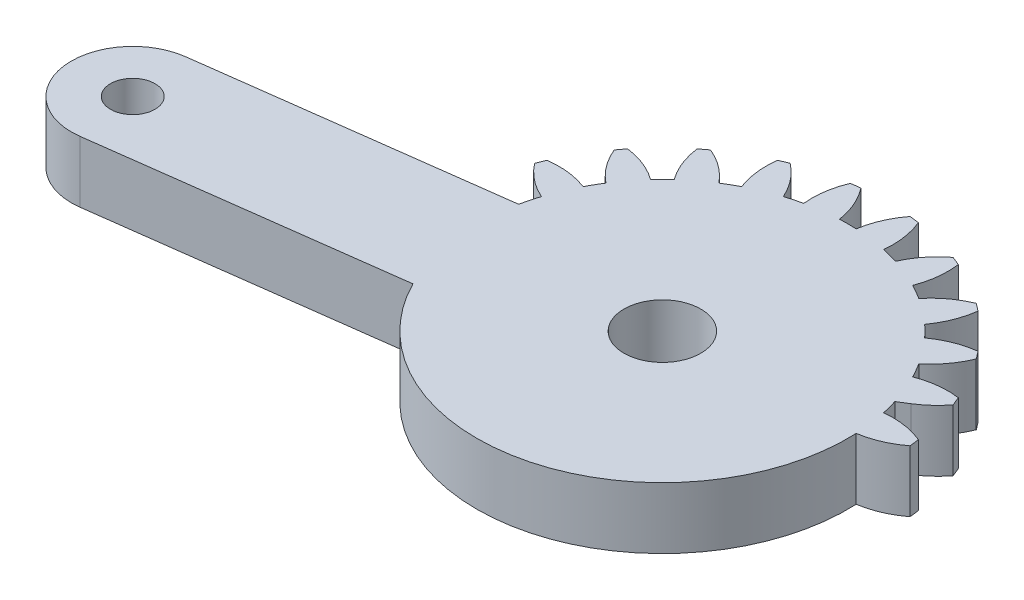
from build123d import *
from build123d.topology import SkipClean

# Parameters (mm, degrees)
SKETCH1_R           = 1.5
BOSS_EXTRUDE1_DEPTH = 4
SKETCH3_R           = 1.45
BOSS_EXTRUDE2_DEPTH = 4
CUT_EXTRUDE1_START  = -4
CUT_EXTRUDE1_DEPTH  = 4
CUT_EXTRUDE2_REACH  = 49.073
SKETCH5_R           = 2.5


with BuildPart() as part:
    # Sketch1 → Boss-Extrude1 (new body)
    with BuildSketch(Plane(origin=(0, 0, 0), x_dir=(1, 0, 0), z_dir=(0, 1, 0))):
        with BuildLine():
            Line((20.643657446, 4), (2.081641936, 4))
            ThreePointArc((2.081641936, 4), (2.861028333, 4.588201733), (3.521749436, 5.30713988))
            ThreePointArc((3.521749436, 5.30713988), (3.405395609, 5.596745198), (3.282888305, 5.883801663))
            ThreePointArc((3.282888305, 5.883801663), (1.93527598, 5.894040025), (0.627094961, 5.57027124))
            ThreePointArc((0.627094961, 5.57027124), (0.366286148, 6.046375), (0.084372603, 6.510293938))
            ThreePointArc((0.084372603, 6.510293938), (1.018855105, 7.48132754), (1.683794586, 8.65351323))
            ThreePointArc((1.683794586, 8.65351323), (1.496450048, 8.903135899), (1.303821399, 9.148703928))
            ThreePointArc((1.303821399, 9.148703928), (-0.000522033, 8.809805691), (-1.180330337, 8.158486898))
            ThreePointArc((-1.180330337, 8.158486898), (-1.555477026, 8.550865528), (-1.947855656, 8.926012217))
            ThreePointArc((-1.947855656, 8.926012217), (-1.296536862, 10.105820521), (-0.957638625, 11.410163953))
            ThreePointArc((-0.957638625, 11.410163953), (-1.203206655, 11.602792602), (-1.452829324, 11.79013714))
            ThreePointArc((-1.452829324, 11.79013714), (-2.625015014, 11.125197659), (-3.596048616, 10.190715157))
            ThreePointArc((-3.596048616, 10.190715157), (-4.059967554, 10.472628702), (-4.536071314, 10.733437515))
            ThreePointArc((-4.536071314, 10.733437515), (-4.212302529, 12.041618533), (-4.222540891, 13.389230859))
            ThreePointArc((-4.222540891, 13.389230859), (-4.509597355, 13.511738163), (-4.799202674, 13.62809199))
            ThreePointArc((-4.799202674, 13.62809199), (-5.759348103, 12.682425791), (-6.455432668, 11.528463019))
            ThreePointArc((-6.455432668, 11.528463019), (-6.976508546, 11.680699536), (-7.503891752, 11.809396783))
            ThreePointArc((-7.503891752, 11.809396783), (-7.529737283, 13.156800143), (-7.888414517, 14.455843809))
            ThreePointArc((-7.888414517, 14.455843809), (-8.197396993, 14.499881098), (-8.507248835, 14.537314892))
            ThreePointArc((-8.507248835, 14.537314892), (-9.18992168, 13.375367565), (-9.563620196, 12.080565177))
            ThreePointArc((-9.563620196, 12.080565177), (-10.106342554, 12.09275), (-10.649064912, 12.080565177))
            ThreePointArc((-10.649064912, 12.080565177), (-11.022763428, 13.375367565), (-11.705436272, 14.537314892))
            ThreePointArc((-11.705436272, 14.537314892), (-12.015288115, 14.499881098), (-12.324270591, 14.455843809))
            ThreePointArc((-12.324270591, 14.455843809), (-12.682947825, 13.156800143), (-12.708793355, 11.809396783))
            ThreePointArc((-12.708793355, 11.809396783), (-13.236176561, 11.680699536), (-13.757252439, 11.528463019))
            ThreePointArc((-13.757252439, 11.528463019), (-14.453337005, 12.682425791), (-15.413482434, 13.62809199))
            ThreePointArc((-15.413482434, 13.62809199), (-15.703087752, 13.511738163), (-15.990144217, 13.389230859))
            ThreePointArc((-15.990144217, 13.389230859), (-16.000382579, 12.041618533), (-15.676613793, 10.733437515))
            ThreePointArc((-15.676613793, 10.733437515), (-16.152717554, 10.472628702), (-16.616636492, 10.190715157))
            ThreePointArc((-16.616636492, 10.190715157), (-17.587670094, 11.125197659), (-18.759855783, 11.79013714))
            ThreePointArc((-18.759855783, 11.79013714), (-19.009478453, 11.602792602), (-19.255046482, 11.410163953))
            ThreePointArc((-19.255046482, 11.410163953), (-18.916148245, 10.105820521), (-18.264829452, 8.926012217))
            ThreePointArc((-18.264829452, 8.926012217), (-18.657208082, 8.550865528), (-19.032354771, 8.158486898))
            ThreePointArc((-19.032354771, 8.158486898), (-20.212163074, 8.809805691), (-21.516506507, 9.148703928))
            ThreePointArc((-21.516506507, 9.148703928), (-21.709135156, 8.903135899), (-21.896479694, 8.65351323))
            ThreePointArc((-21.896479694, 8.65351323), (-21.231540213, 7.48132754), (-20.297057711, 6.510293938))
            ThreePointArc((-20.297057711, 6.510293938), (-20.578971255, 6.046375), (-20.839780068, 5.57027124))
            ThreePointArc((-20.839780068, 5.57027124), (-22.147961087, 5.894040025), (-23.495573413, 5.883801663))
            ThreePointArc((-23.495573413, 5.883801663), (-23.618080717, 5.596745198), (-23.734434544, 5.30713988))
            ThreePointArc((-23.734434544, 5.30713988), (-22.788768345, 4.346994451), (-21.634805572, 3.650909885))
            ThreePointArc((-21.634805572, 3.650909885), (-21.78704209, 3.129834008), (-21.915739337, 2.602450802))
            ThreePointArc((-21.915739337, 2.602450802), (-23.263142697, 2.576605271), (-24.562186363, 2.217928037))
            ThreePointArc((-24.562186363, 2.217928037), (-24.606223651, 1.908945561), (-24.643657446, 1.599093719))
            ThreePointArc((-24.643657446, 1.599093719), (-23.481710119, 0.916420874), (-22.186907731, 0.542722358))
            ThreePointArc((-22.186907731, 0.542722358), (-22.199092554, 0), (-22.186907731, -0.542722358))
            ThreePointArc((-22.186907731, -0.542722358), (-23.481710119, -0.916420874), (-24.643657446, -1.599093719))
            ThreePointArc((-24.643657446, -1.599093719), (-24.606223651, -1.908945561), (-24.562186363, -2.217928037))
            ThreePointArc((-24.562186363, -2.217928037), (-23.263142697, -2.576605271), (-21.915739337, -2.602450802))
            ThreePointArc((-21.915739337, -2.602450802), (-21.78704209, -3.129834008), (-21.634805572, -3.650909885))
            ThreePointArc((-21.634805572, -3.650909885), (-22.788768345, -4.346994451), (-23.734434544, -5.30713988))
            ThreePointArc((-23.734434544, -5.30713988), (-23.618080717, -5.596745198), (-23.495573413, -5.883801663))
            ThreePointArc((-23.495573413, -5.883801663), (-22.147961087, -5.894040025), (-20.839780068, -5.57027124))
            ThreePointArc((-20.839780068, -5.57027124), (-20.578971255, -6.046375), (-20.297057711, -6.510293938))
            ThreePointArc((-20.297057711, -6.510293938), (-21.231540213, -7.48132754), (-21.896479694, -8.65351323))
            ThreePointArc((-21.896479694, -8.65351323), (-21.709135156, -8.903135899), (-21.516506507, -9.148703928))
            ThreePointArc((-21.516506507, -9.148703928), (-20.212163074, -8.809805691), (-19.032354771, -8.158486898))
            ThreePointArc((-19.032354771, -8.158486898), (-18.657208082, -8.550865528), (-18.264829452, -8.926012217))
            ThreePointArc((-18.264829452, -8.926012217), (-18.916148245, -10.105820521), (-19.255046482, -11.410163953))
            ThreePointArc((-19.255046482, -11.410163953), (-19.009478453, -11.602792602), (-18.759855783, -11.79013714))
            ThreePointArc((-18.759855783, -11.79013714), (-17.587670094, -11.125197659), (-16.616636492, -10.190715157))
            ThreePointArc((-16.616636492, -10.190715157), (-16.152717554, -10.472628702), (-15.676613793, -10.733437515))
            ThreePointArc((-15.676613793, -10.733437515), (-16.000382579, -12.041618533), (-15.990144217, -13.389230859))
            ThreePointArc((-15.990144217, -13.389230859), (-15.703087752, -13.511738163), (-15.413482434, -13.62809199))
            ThreePointArc((-15.413482434, -13.62809199), (-14.453337005, -12.682425791), (-13.757252439, -11.528463019))
            ThreePointArc((-13.757252439, -11.528463019), (-13.236176561, -11.680699536), (-12.708793355, -11.809396783))
            ThreePointArc((-12.708793355, -11.809396783), (-12.682947825, -13.156800143), (-12.324270591, -14.455843809))
            ThreePointArc((-12.324270591, -14.455843809), (-12.015288115, -14.499881098), (-11.705436272, -14.537314892))
            ThreePointArc((-11.705436272, -14.537314892), (-11.022763428, -13.375367565), (-10.649064912, -12.080565177))
            ThreePointArc((-10.649064912, -12.080565177), (-10.106342554, -12.09275), (-9.563620196, -12.080565177))
            ThreePointArc((-9.563620196, -12.080565177), (-9.18992168, -13.375367565), (-8.507248835, -14.537314892))
            ThreePointArc((-8.507248835, -14.537314892), (-8.197396993, -14.499881098), (-7.888414517, -14.455843809))
            ThreePointArc((-7.888414517, -14.455843809), (-7.529737283, -13.156800143), (-7.503891752, -11.809396783))
            ThreePointArc((-7.503891752, -11.809396783), (-6.976508546, -11.680699536), (-6.455432668, -11.528463019))
            ThreePointArc((-6.455432668, -11.528463019), (-5.759348103, -12.682425791), (-4.799202674, -13.62809199))
            ThreePointArc((-4.799202674, -13.62809199), (-4.509597355, -13.511738163), (-4.222540891, -13.389230859))
            ThreePointArc((-4.222540891, -13.389230859), (-4.212302529, -12.041618533), (-4.536071314, -10.733437515))
            ThreePointArc((-4.536071314, -10.733437515), (-4.059967554, -10.472628702), (-3.596048616, -10.190715157))
            ThreePointArc((-3.596048616, -10.190715157), (-2.625015014, -11.125197659), (-1.452829324, -11.79013714))
            ThreePointArc((-1.452829324, -11.79013714), (-1.203206655, -11.602792602), (-0.957638625, -11.410163953))
            ThreePointArc((-0.957638625, -11.410163953), (-1.296536862, -10.105820521), (-1.947855656, -8.926012217))
            ThreePointArc((-1.947855656, -8.926012217), (-1.555477026, -8.550865528), (-1.180330337, -8.158486898))
            ThreePointArc((-1.180330337, -8.158486898), (-0.000522033, -8.809805691), (1.303821399, -9.148703928))
            ThreePointArc((1.303821399, -9.148703928), (1.496450048, -8.903135899), (1.683794586, -8.65351323))
            ThreePointArc((1.683794586, -8.65351323), (1.018855105, -7.48132754), (0.084372603, -6.510293938))
            ThreePointArc((0.084372603, -6.510293938), (0.366286148, -6.046375), (0.627094961, -5.57027124))
            ThreePointArc((0.627094961, -5.57027124), (1.93527598, -5.894040025), (3.282888305, -5.883801663))
            ThreePointArc((3.282888305, -5.883801663), (3.405395609, -5.596745198), (3.521749436, -5.30713988))
            ThreePointArc((3.521749436, -5.30713988), (2.861028333, -4.588201733), (2.081641936, -4))
            Line((2.081641936, -4), (20.643657446, -4))
            ThreePointArc((20.643657446, -4), (24.643657446, 0), (20.643657446, 4))
        make_face()
        with Locations(Location((-10.106342554, 0, 0), (0, 0, 270))):
            Circle(SKETCH1_R, mode=Mode.SUBTRACT)
        with Locations(Location((20.643657446, 0, 0), (0, 0, 270))):
            Circle(SKETCH1_R, mode=Mode.SUBTRACT)
    extrude(amount=BOSS_EXTRUDE1_DEPTH)

    # Sketch3 → Boss-Extrude2 (add)
    with BuildSketch(Plane(origin=(0, 4, 0), x_dir=(1, 0, 0), z_dir=(0, 1, 0))):
        with BuildLine():
            ThreePointArc((-9.584237785, -3.965779445), (-14.072121999, -0.522104769), (-10.628447323, 3.965779445))
            Line((-10.628447323, 3.965779445), (-41.11537681, -0.047900965))
            ThreePointArc((-41.11537681, -0.047900965), (-44.559051487, -4.53578518), (-40.071167272, -7.979459856))
            Line((-40.071167272, -7.979459856), (-9.584237785, -3.965779445))
        make_face()
        with Locations(Location((-40.593272041, -4.013680411, 0), (0, 0, 270))):
            Circle(SKETCH3_R, mode=Mode.SUBTRACT)
    extrude(amount=-BOSS_EXTRUDE2_DEPTH)

    # Sketch4 → Cut-Extrude1 (cut)
    with SkipClean():  # the faces are left unmerged after this step: merging them gives an invalid solid
        with BuildSketch(Plane(origin=(0, 4, 0), x_dir=(1, 0, 0), z_dir=(0, 1, 0)).offset(CUT_EXTRUDE1_START)):
            with BuildLine():
                ThreePointArc((20.643657446, -4), (24.643657446, 0), (20.643657446, 4))
                Line((20.643657446, 4), (2.081641936, 4))
                Line((2.081641936, 4), (1.43808022, 3.600125745))
                ThreePointArc((1.43808022, 3.600125745), (1.581217534, 3.104116905), (1.70305423, 2.602450802))
                ThreePointArc((1.70305423, 2.602450802), (3.050457589, 2.576605271), (4.349501255, 2.217928037))
                ThreePointArc((4.349501255, 2.217928037), (4.393538544, 1.908945561), (4.430972339, 1.599093719))
                ThreePointArc((4.430972339, 1.599093719), (3.269025011, 0.916420874), (1.974222624, 0.542722358))
                ThreePointArc((1.974222624, 0.542722358), (1.70305423, -2.602450802), (0.627094961, -5.57027124))
                ThreePointArc((0.627094961, -5.57027124), (1.93527598, -5.894040025), (3.282888305, -5.883801663))
                ThreePointArc((3.282888305, -5.883801663), (3.405395609, -5.596745198), (3.521749436, -5.30713988))
                ThreePointArc((3.521749436, -5.30713988), (2.861028333, -4.588201733), (2.081641936, -4))
                Line((2.081641936, -4), (20.643657446, -4))
            make_face()
            with BuildLine():
                ThreePointArc((1.683794586, -8.65351323), (1.018855105, -7.48132754), (0.084372603, -6.510293938))
                ThreePointArc((0.084372603, -6.510293938), (-0.512518948, -7.361599771), (-1.180330337, -8.158486898))
                ThreePointArc((-1.180330337, -8.158486898), (-0.000522033, -8.809805691), (1.303821399, -9.148703928))
                ThreePointArc((1.303821399, -9.148703928), (1.496450048, -8.903135899), (1.683794586, -8.65351323))
            make_face()
            with BuildLine():
                ThreePointArc((-0.957638625, -11.410163953), (-1.296536862, -10.105820521), (-1.947855656, -8.926012217))
                ThreePointArc((-1.947855656, -8.926012217), (-2.744742783, -9.593823606), (-3.596048616, -10.190715157))
                ThreePointArc((-3.596048616, -10.190715157), (-2.625015014, -11.125197659), (-1.452829324, -11.79013714))
                ThreePointArc((-1.452829324, -11.79013714), (-1.203206655, -11.602792602), (-0.957638625, -11.410163953))
            make_face()
            with BuildLine():
                ThreePointArc((-4.222540891, -13.389230859), (-4.212302529, -12.041618533), (-4.536071314, -10.733437515))
                ThreePointArc((-4.536071314, -10.733437515), (-5.478647477, -11.172244217), (-6.455432668, -11.528463019))
                ThreePointArc((-6.455432668, -11.528463019), (-5.759348103, -12.682425791), (-4.799202674, -13.62809199))
                ThreePointArc((-4.799202674, -13.62809199), (-4.509597355, -13.511738163), (-4.222540891, -13.389230859))
            make_face()
            with BuildLine():
                ThreePointArc((-7.888414517, -14.455843809), (-7.529737283, -13.156800143), (-7.503891752, -11.809396783))
                ThreePointArc((-7.503891752, -11.809396783), (-8.527921943, -11.989294847), (-9.563620196, -12.080565177))
                ThreePointArc((-9.563620196, -12.080565177), (-9.18992168, -13.375367565), (-8.507248835, -14.537314892))
                ThreePointArc((-8.507248835, -14.537314892), (-8.197396993, -14.499881098), (-7.888414517, -14.455843809))
            make_face()
            with BuildLine():
                ThreePointArc((-11.705436272, -14.537314892), (-11.022763428, -13.375367565), (-10.649064912, -12.080565177))
                ThreePointArc((-10.649064912, -12.080565177), (-11.684763165, -11.989294847), (-12.708793355, -11.809396783))
                ThreePointArc((-12.708793355, -11.809396783), (-12.682947825, -13.156800143), (-12.324270591, -14.455843809))
                ThreePointArc((-12.324270591, -14.455843809), (-12.015288115, -14.499881098), (-11.705436272, -14.537314892))
            make_face()
            with BuildLine():
                ThreePointArc((-15.413482434, -13.62809199), (-14.453337005, -12.682425791), (-13.757252439, -11.528463019))
                ThreePointArc((-13.757252439, -11.528463019), (-14.734037631, -11.172244217), (-15.676613793, -10.733437515))
                ThreePointArc((-15.676613793, -10.733437515), (-16.000382579, -12.041618533), (-15.990144217, -13.389230859))
                ThreePointArc((-15.990144217, -13.389230859), (-15.703087752, -13.511738163), (-15.413482434, -13.62809199))
            make_face()
            with BuildLine():
                ThreePointArc((-18.759855783, -11.79013714), (-17.587670094, -11.125197659), (-16.616636492, -10.190715157))
                ThreePointArc((-16.616636492, -10.190715157), (-17.467942324, -9.593823606), (-18.264829452, -8.926012217))
                ThreePointArc((-18.264829452, -8.926012217), (-18.916148245, -10.105820521), (-19.255046482, -11.410163953))
                ThreePointArc((-19.255046482, -11.410163953), (-19.009478453, -11.602792602), (-18.759855783, -11.79013714))
            make_face()
            with BuildLine():
                ThreePointArc((-21.516506507, -9.148703928), (-20.212163074, -8.809805691), (-19.032354771, -8.158486898))
                ThreePointArc((-19.032354771, -8.158486898), (-19.70016616, -7.361599771), (-20.297057711, -6.510293938))
                ThreePointArc((-20.297057711, -6.510293938), (-21.231540213, -7.48132754), (-21.896479694, -8.65351323))
                ThreePointArc((-21.896479694, -8.65351323), (-21.709135156, -8.903135899), (-21.516506507, -9.148703928))
            make_face()
            with BuildLine():
                ThreePointArc((-21.942853375, 2.47620963), (-21.92946485, 2.539366405), (-21.915739337, 2.602450802))
                ThreePointArc((-21.915739337, 2.602450802), (-23.263142697, 2.576605271), (-24.562186363, 2.217928037))
                ThreePointArc((-24.562186363, 2.217928037), (-24.56889027, 2.173784387), (-24.575459377, 2.129620475))
                Line((-24.575459377, 2.129620475), (-21.942853375, 2.47620963))
            make_face()
            with BuildLine():
                ThreePointArc((-23.495573413, -5.883801663), (-22.147961087, -5.894040025), (-20.839780068, -5.57027124))
                ThreePointArc((-20.839780068, -5.57027124), (-20.869365339, -5.512888815), (-20.898643838, -5.455349261))
                Line((-20.898643838, -5.455349261), (-23.531249839, -5.801938416))
                ThreePointArc((-23.531249839, -5.801938416), (-23.513474108, -5.842897269), (-23.495573413, -5.883801663))
            make_face()
        extrude(amount=CUT_EXTRUDE1_DEPTH, mode=Mode.SUBTRACT)

    # Sketch5 → Cut-Extrude2 (cut, up to next)
    with BuildSketch(Plane(origin=(0, 4, 0), x_dir=(1, 0, 0), z_dir=(0, 1, 0)), mode=Mode.PRIVATE) as cut_extrude2_sk1:
        with Locations(Location((-10.106342554, 0, 0), (0, 0, 270))):
            Circle(SKETCH5_R)
    cut_extrude2_tool1 = extrude(cut_extrude2_sk1.sketch, amount=-CUT_EXTRUDE2_REACH, mode=Mode.PRIVATE) & part.part
    add(cut_extrude2_tool1.solids().sort_by_distance((-10.106343, 4, 0))[0], mode=Mode.SUBTRACT)


solid = part.part
